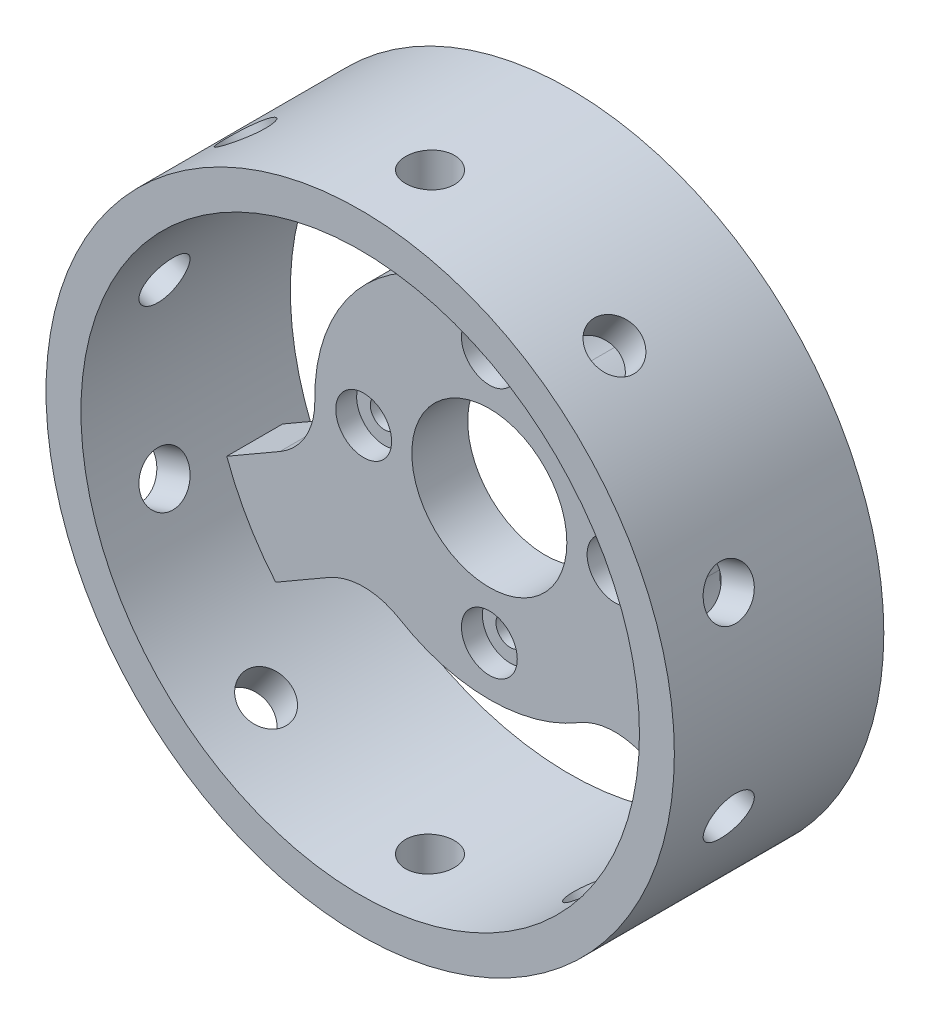
from build123d import *

# Parameters (mm, degrees)
SKETCH1_R               = 45
BOSS_EXTRUDE1_DEPTH     = 30
CUT_EXTRUDE1_DEPTH      = 71.356236397
CUT_EXTRUDE1_DEPTH_BACK = 71.356236397
SKETCH2_R               = 40
BOSS_EXTRUDE3_START     = 3.5
SKETCH5_R               = 25
BOSS_EXTRUDE3_DEPTH     = 8
BOSS_EXTRUDE4_START     = 3.5
SKETCH6_W               = 14
SKETCH6_H               = 17
BOSS_EXTRUDE4_DEPTH     = 8
SKETCH9_R               = 11.1
CUT_EXTRUDE4_DEPTH      = 71.356236397
SKETCH10_R              = 2.05
CUT_EXTRUDE5_DEPTH      = 71.356236397
CUT_EXTRUDE6_START      = 8.5
SKETCH11_R              = 4
CUT_EXTRUDE6_DEPTH      = 3
FILLET1_R               = 10
SKETCH12_R              = 3.5
CUT_EXTRUDE7_DEPTH      = 71.356236397
CIRPATTERN1_COUNT       = 10


with BuildPart() as part:
    # Sketch1 → Boss-Extrude1 (new body)
    with BuildSketch(Plane.XY):
        Circle(SKETCH1_R)
    extrude(amount=BOSS_EXTRUDE1_DEPTH)

    # Sketch2 → Cut-Extrude1 (cut, two sides: drawn at the far end of the back side and taken through both)
    with BuildSketch(Plane.XY.offset(-CUT_EXTRUDE1_DEPTH_BACK)):
        Circle(SKETCH2_R)
    extrude(amount=CUT_EXTRUDE1_DEPTH + CUT_EXTRUDE1_DEPTH_BACK, mode=Mode.SUBTRACT)



with BuildPart() as body_2:
    # Sketch5 → Boss-Extrude3 (new body)
    with BuildSketch(Plane.XY.offset(BOSS_EXTRUDE3_START)):
        Circle(SKETCH5_R)
    extrude(amount=BOSS_EXTRUDE3_DEPTH)


with BuildPart() as part_1:
    add(part.part)

    add(body_2.part)  # Boss-Extrude4 merges body 2
    # Sketch6 → Boss-Extrude4 (add)
    with BuildSketch(Plane.XY.offset(BOSS_EXTRUDE4_START)):
        with Locations((0, 32.5)):
            Rectangle(SKETCH6_W, SKETCH6_H)
        Polygon((17.284609691, -18.062177826), (32.007041555, -26.562177826), (39.007041555, -14.437822174), (24.284609691, -5.937822174), align=None)
        Polygon((-17.284609691, -18.062177826), (-32.007041555, -26.562177826), (-39.007041555, -14.437822174), (-24.284609691, -5.937822174), align=None)
    extrude(amount=BOSS_EXTRUDE4_DEPTH)

    # Sketch9 → Cut-Extrude4 (cut, through all)
    with BuildSketch(Plane.XY):
        Circle(SKETCH9_R)
    extrude(amount=CUT_EXTRUDE4_DEPTH, mode=Mode.SUBTRACT)

    # Sketch10 → Cut-Extrude5 (cut, through all)
    with BuildSketch(Plane.XY):
        with Locations((0, 18)):
            Circle(SKETCH10_R)
        with Locations((18, 0)):
            Circle(SKETCH10_R)
        with Locations((0, -18)):
            Circle(SKETCH10_R)
        with Locations((-18, 0)):
            Circle(SKETCH10_R)
    extrude(amount=CUT_EXTRUDE5_DEPTH, mode=Mode.SUBTRACT)

    # Sketch11 → Cut-Extrude6 (cut)
    with BuildSketch(Plane.XY.offset(CUT_EXTRUDE6_START)):
        with Locations((18, 0)):
            Circle(SKETCH11_R)
        with Locations((0, -18)):
            Circle(SKETCH11_R)
        with Locations((-18, 0)):
            Circle(SKETCH11_R)
        with Locations((0, 18)):
            Circle(SKETCH11_R)
    extrude(amount=CUT_EXTRUDE6_DEPTH, mode=Mode.SUBTRACT)

    # Fillet1
    fillet1_edges = [part_1.edges().sort_by_distance(p)[0] for p in [
        (-7, 24, 7.5),
        (7, 24, 7.5),
        (24.284609691, -5.937822174, 7.5),
        (17.284609691, -18.062177826, 7.5),
        (-17.284609691, -18.062177826, 7.5),
        (-24.284609691, -5.937822174, 7.5),
    ]]
    fillet(fillet1_edges, radius=FILLET1_R)

    # Sketch12 → Cut-Extrude7 (cut, symmetric)
    with BuildSketch(Plane(origin=(0, 0, 0), x_dir=(1, 0, 0), z_dir=(0, 1, 0))):
        with Locations(Location((0, -20, 0), (0, 0, 270))):
            Circle(SKETCH12_R)
    cut_extrude7 = extrude(amount=CUT_EXTRUDE7_DEPTH, both=True, mode=Mode.SUBTRACT)

    # CirPattern1: Cut-Extrude7 ×10 about axis
    cirpattern1_axis = Axis((0, 0, 30), (0, 0, -1))
    for i in range(1, CIRPATTERN1_COUNT):
        add(cut_extrude7.rotate(cirpattern1_axis, i * 360 / CIRPATTERN1_COUNT), mode=Mode.SUBTRACT)


solid = part_1.part
